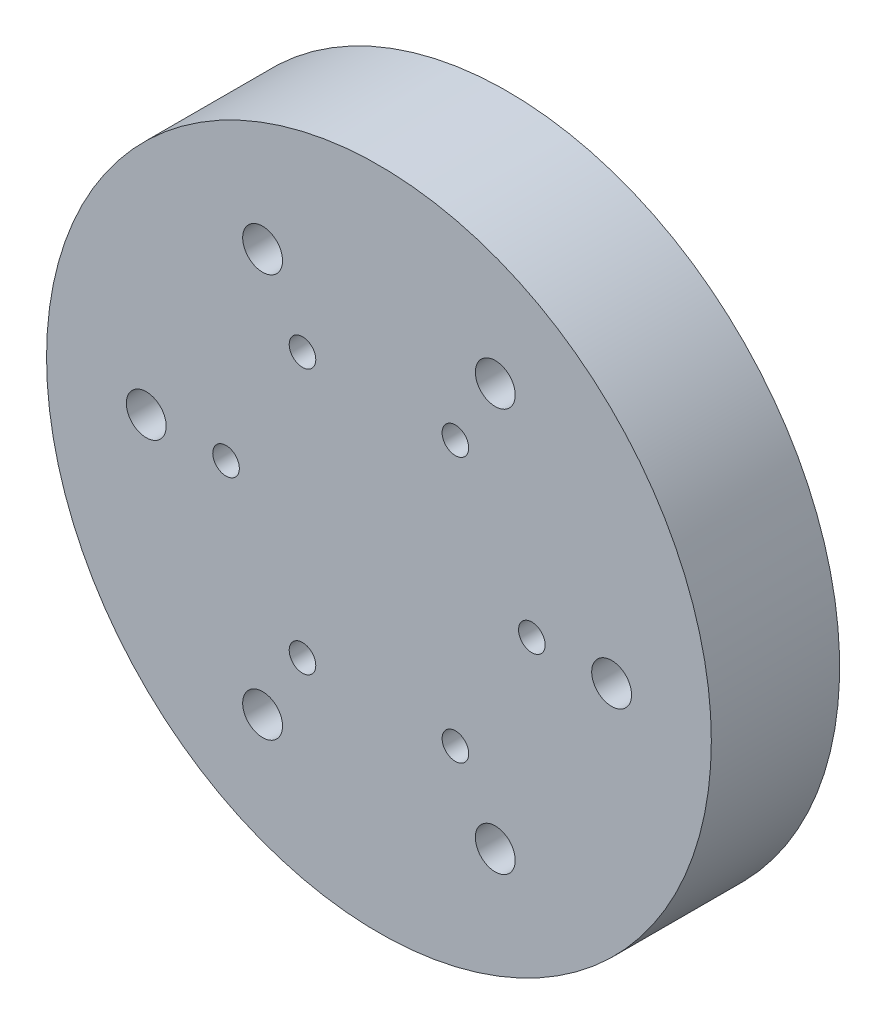
from build123d import *

# Parameters (mm, degrees)
SKETCH_1_R               = 50
SKETCH_1_R_2             = 3
SKETCH_1_R_3             = 2
EXTRUDE_1_DEPTH          = 20
SKETCH_3_R               = 82.232653787
CUT_EXTRUDE_1_DEPTH      = 10
EXTRUDE_START            = 9.3
SKETCH_4_R               = 50
EXTRUDE_2_DEPTH          = 9.3
CUT_EXTRUDE_START        = -52
SKETCH_5_R               = 3
SKETCH_5_R_2             = 2
CUT_EXTRUDE_2_DEPTH      = 52
PATTERN_CIRCULAR_1_COUNT = 6


with BuildPart() as part:
    # 草图1 → 凸台-拉伸1 (new body)
    with BuildSketch(Plane.XY):
        Circle(SKETCH_1_R)
        with Locations((-35, 0)):
            Circle(SKETCH_1_R_2, mode=Mode.SUBTRACT)
        with Locations((-17.5, 30.310889132)):
            Circle(SKETCH_1_R_2, mode=Mode.SUBTRACT)
        with Locations((17.5, 30.310889132)):
            Circle(SKETCH_1_R_2, mode=Mode.SUBTRACT)
        with Locations((35, 0)):
            Circle(SKETCH_1_R_2, mode=Mode.SUBTRACT)
        with Locations((17.5, -30.310889132)):
            Circle(SKETCH_1_R_2, mode=Mode.SUBTRACT)
        with Locations((-17.5, -30.310889132)):
            Circle(SKETCH_1_R_2, mode=Mode.SUBTRACT)
        with Locations((-23, 0)):
            Circle(SKETCH_1_R_3, mode=Mode.SUBTRACT)
        with Locations((-11.5, 19.918584287)):
            Circle(SKETCH_1_R_3, mode=Mode.SUBTRACT)
        with Locations((11.5, 19.918584287)):
            Circle(SKETCH_1_R_3, mode=Mode.SUBTRACT)
        with Locations((23, 0)):
            Circle(SKETCH_1_R_3, mode=Mode.SUBTRACT)
        with Locations((11.5, -19.918584287)):
            Circle(SKETCH_1_R_3, mode=Mode.SUBTRACT)
        with Locations((-11.5, -19.918584287)):
            Circle(SKETCH_1_R_3, mode=Mode.SUBTRACT)
    extrude(amount=EXTRUDE_1_DEPTH)

    # 草图3 → 切除-拉伸1 (cut)
    with BuildSketch(Plane.XY.offset(20)):
        Circle(SKETCH_3_R)
    extrude(amount=-CUT_EXTRUDE_1_DEPTH, mode=Mode.SUBTRACT)

    # 草图4 → 凸台-拉伸2 (add)
    with BuildSketch(Plane(origin=(0, 0, 0), x_dir=(-1, 0, 0), z_dir=(0, 0, -1)).offset(EXTRUDE_START)):
        Circle(SKETCH_4_R)
    extrude(amount=-EXTRUDE_2_DEPTH)

    # 草图5 → 切除-拉伸2 (cut)
    with BuildSketch(Plane.XY.offset(10).offset(CUT_EXTRUDE_START)):
        with Locations(Location((-35, 0, 0), (0, 0, 180))):
            Circle(SKETCH_5_R)
        with Locations(Location((-23, 0, 0), (0, 0, 180))):
            Circle(SKETCH_5_R_2)
    cut_extrude_2 = extrude(amount=CUT_EXTRUDE_2_DEPTH, mode=Mode.SUBTRACT)

    # 阵列(圆周)1: 切除-拉伸2 ×6 about axis
    pattern_circular_1_axis = Axis((0, 0, 20), (0, 0, -1))
    for i in range(1, PATTERN_CIRCULAR_1_COUNT):
        add(cut_extrude_2.rotate(pattern_circular_1_axis, i * 360 / PATTERN_CIRCULAR_1_COUNT), mode=Mode.SUBTRACT)


solid = part.part
